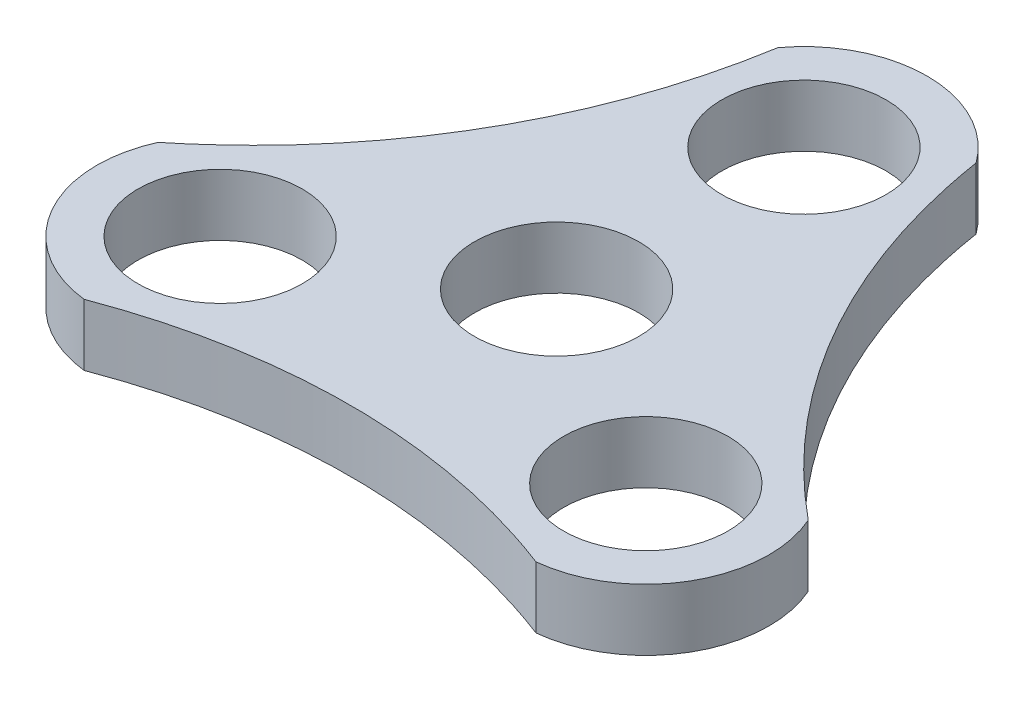
from build123d import *

# Parameters (mm, degrees)
SKETCH2_R           = 6.35
BOSS_EXTRUDE1_DEPTH = 4.7625


with BuildPart() as part:
    # Sketch2 → Boss-Extrude1 (new body)
    with BuildSketch(Plane(origin=(0, 0, 0), x_dir=(1, 0, 0), z_dir=(0, 1, 0))):
        with BuildLine():
            ThreePointArc((7.763480479, 24.65151799), (0.088455744, 28.574863042), (-7.61008297, 24.69786127))
            add(Edge.make_bspline(
                [(-7.61008297, 24.69786127), (-9.592104105, 12.649393813), (-15.73585932, 2.097225899), (-25.22422914, -5.588137723)],
                knots=[0, 0, 0, 0, 1, 1, 1, 1], degree=3))
            ThreePointArc((-25.22422914, -5.588137723), (-24.792958655, -14.207033662), (-17.57711737, -18.940213988))
            add(Edge.make_bspline(
                [(-17.57711737, -18.940213988), (-6.152008529, -14.631981889), (6.058316415, -14.676034081), (17.458404858, -19.050043608)],
                knots=[0, 0, 0, 0, 1, 1, 1, 1], degree=3))
            ThreePointArc((17.458404858, -19.050043608), (24.704052244, -14.361071884), (25.187751026, -5.744117819))
            add(Edge.make_bspline(
                [(25.187751026, -5.744117819), (15.743744455, 1.995695857), (9.676165927, 12.591849246), (7.763480479, 24.65151799)],
                knots=[0, 0, 0, 0, 1, 1, 1, 1], degree=3))
        make_face()
        with Locations(Location((0, 0, 0), (0, 0, 90))):
            Circle(SKETCH2_R, mode=Mode.SUBTRACT)
        with Locations(Location((0.059742965, 19.049906319, 0), (0, 0, 90))):
            Circle(SKETCH2_R, mode=Mode.SUBTRACT)
        with Locations(Location((16.46783133, -9.576692085, 0), (0, 0, 90))):
            Circle(SKETCH2_R, mode=Mode.SUBTRACT)
        with Locations(Location((-16.527574295, -9.473214235, 0), (0, 0, 90))):
            Circle(SKETCH2_R, mode=Mode.SUBTRACT)
    extrude(amount=BOSS_EXTRUDE1_DEPTH)


solid = part.part
